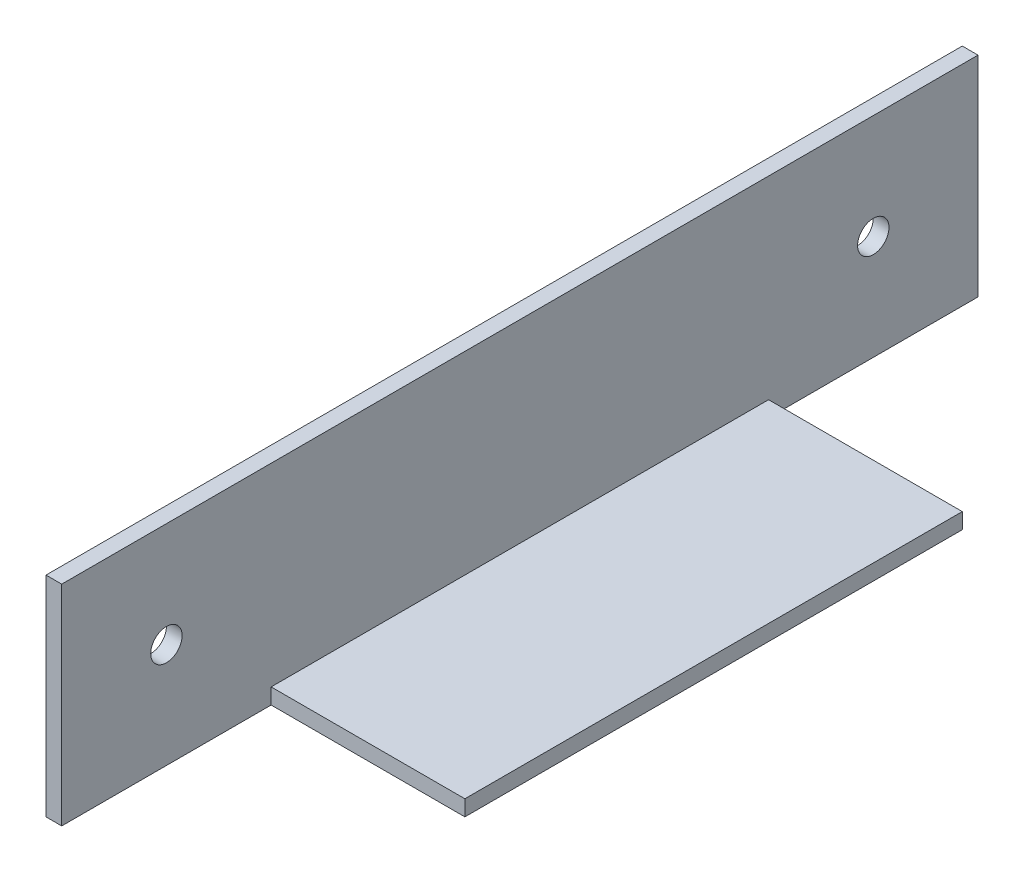
from build123d import *

# Parameters (mm, degrees)
EXTRUSION1_DEPTH = 87.5
ESQUISSE3_R      = 1.5
EXTRUSION3_DEPTH = 10
ESQUISSE4_W      = 18.5
ESQUISSE4_H      = 20
EXTRUSION4_DEPTH = 1.5


with BuildPart() as part:
    # Esquisse1 → Extrusion1 (new body)
    with BuildSketch(Plane.XY):
        Polygon((0, 0), (20, 0), (20, 1.5), (1.5, 1.5), (1.5, 20), (0, 20), align=None)
    extrude(amount=EXTRUSION1_DEPTH)

    # Esquisse3 → Extrusion3 (cut)
    with BuildSketch(Plane.ZY):
        with Locations(Location((77.5, 10, 0), (0, 0, 270))):
            Circle(ESQUISSE3_R)
        with Locations(Location((10, 10, 0), (0, 0, 270))):
            Circle(ESQUISSE3_R)
    extrude(amount=-EXTRUSION3_DEPTH, mode=Mode.SUBTRACT)

    # Esquisse4 → Extrusion4 (cut)
    with BuildSketch(Plane.XZ):
        with Locations((10.75, 10)):
            Rectangle(ESQUISSE4_W, ESQUISSE4_H)
        with Locations((10.75, 77.5)):
            Rectangle(ESQUISSE4_W, ESQUISSE4_H)
    extrude(amount=-EXTRUSION4_DEPTH, mode=Mode.SUBTRACT)


solid = part.part
